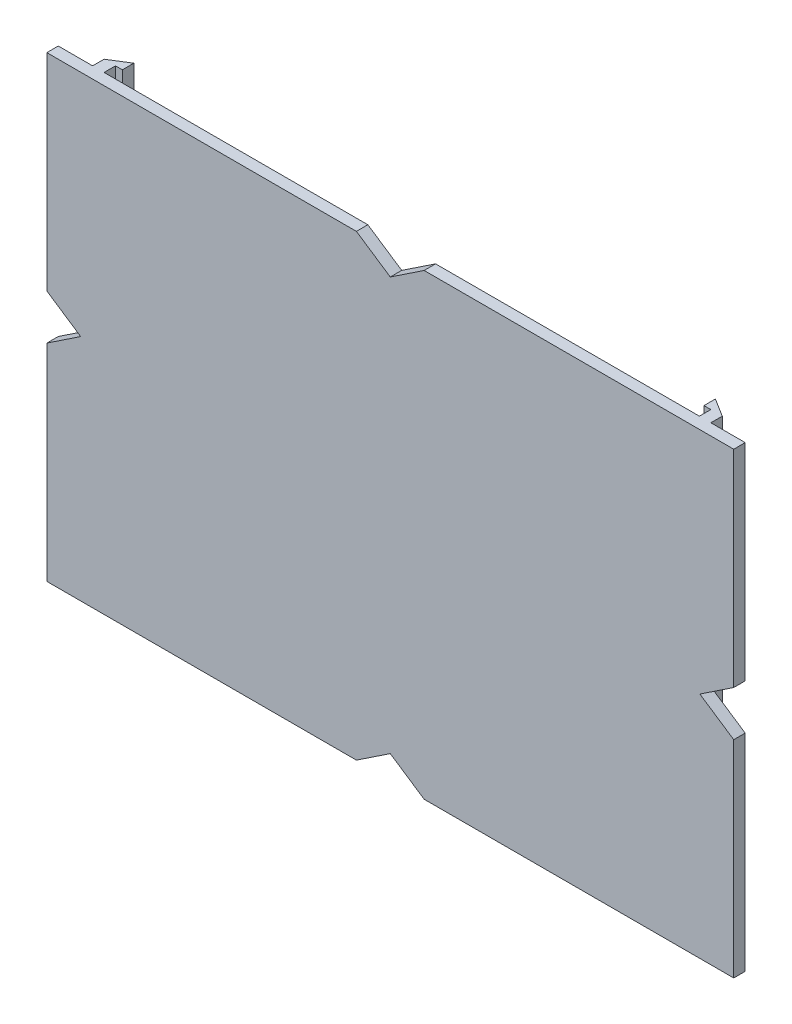
from build123d import *

# Parameters (mm, degrees)
BOSS_EXTRUDE1_DEPTH = 5
BOSS_EXTRUDE2_DEPTH = 200


with BuildPart() as part:
    # Sketch1 → Boss-Extrude1 (new body)
    with BuildSketch(Plane.XY):
        Polygon((-150, 100), (-150, 9.861218113), (-135.20817283, 0), (-150, -9.861218113), (-150, -100), (-14.79182717, -100), (0, -90.138781887), (14.79182717, -100), (150, -100), (150, -9.861218113), (135.20817283, 0), (150, 9.861218113), (150, 100), (14.79182717, 100), (0, 90.138781887), (-14.79182717, 100), align=None)
    extrude(amount=BOSS_EXTRUDE1_DEPTH)

    # Sketch2 → Boss-Extrude2 (add)
    with BuildSketch(Plane(origin=(0, 100, 0), x_dir=(1, 0, 0), z_dir=(0, 1, 0))):
        Polygon((-135, 0), (-130, 0), (-130, 5), (-127, 5), (-127, 10), (-135, 5), align=None)
    boss_extrude2 = extrude(amount=-BOSS_EXTRUDE2_DEPTH)

    # Mirror1: Boss-Extrude2 across plane
    add(boss_extrude2.mirror(Plane(origin=(0, 0, 0), x_dir=(0, 0, 1), z_dir=(1, 0, 0))))


solid = part.part
